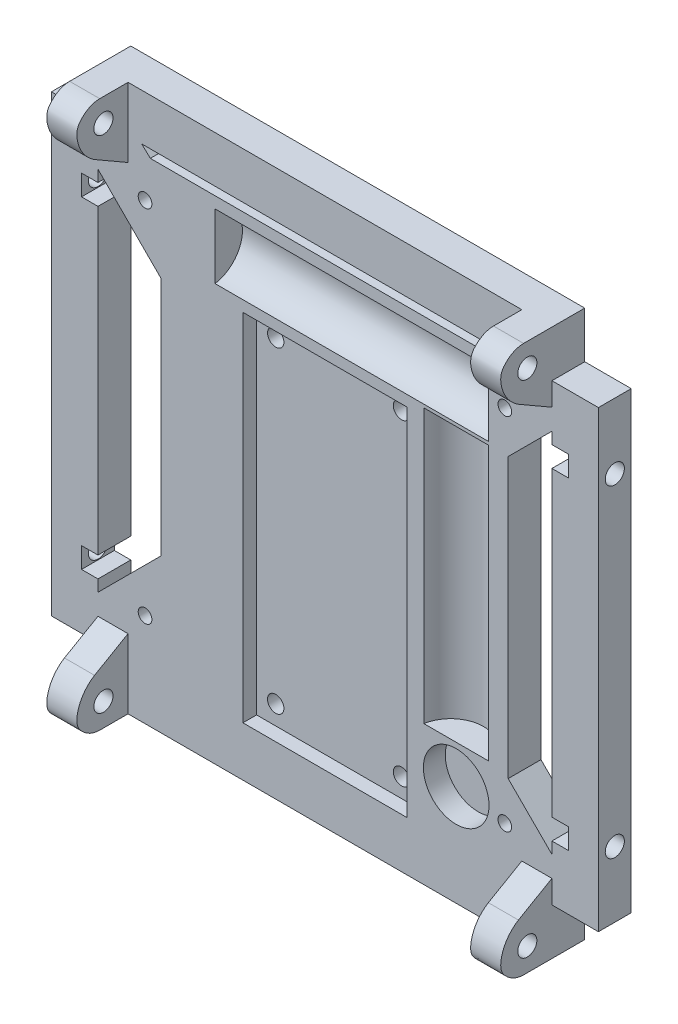
from build123d import *

# Parameters (mm, degrees)
BOSS_EXTRUDE1_DEPTH      = 6
CUT_EXTRUDE1_DEPTH       = 6
BOSS_EXTRUDE2_DEPTH      = 5.5
MIRROR2_COPY_1_DEPTH     = 5.5
SKETCH4_R                = 1.25
CUT_EXTRUDE2_DEPTH       = 73.359459738
MIRROR4_COPY_1_SKETCH_R  = 1.25
MIRROR4_COPY_1_DEPTH     = 73.359459738
SKETCH5_R                = 1.75
CUT_EXTRUDE3_DEPTH       = 5.5
CUT_EXTRUDE4_REACH       = 74.359
SKETCH7_W                = 3
SKETCH7_H                = 3.77
MIRROR8_COPY_1_REACH     = 74.359
MIRROR8_COPY_1_SKETCH_W  = 3
MIRROR8_COPY_1_SKETCH_H  = 3.77
MIRROR12_COPY_1_SKETCH_R = 1.75
MIRROR12_COPY_1_DEPTH    = 5.5
CUT_EXTRUDE7_DEPTH       = 50
CUT_EXTRUDE8_DEPTH       = 50
SKETCH14_R               = 6
CUT_EXTRUDE9_DEPTH       = 4
SKETCH15_W               = 30
SKETCH15_H               = 65
CUT_EXTRUDE10_DEPTH      = 2.5
SKETCH17_R               = 1.5
CUT_EXTRUDE11_DEPTH      = 5


with BuildPart() as part:
    # Sketch1 → Boss-Extrude1 (new body)
    with BuildSketch(Plane.XY):
        Polygon((-41.5, 50), (41.5, 50), (41.5, 41.5), (50, 41.5), (50, -41.5), (41.5, -41.5), (41.5, -50), (-41.5, -50), (-41.5, -41.5), (-50, -41.5), (-50, 41.5), (-41.5, 41.5), align=None)
    extrude(amount=BOSS_EXTRUDE1_DEPTH)

    # Sketch2 → Cut-Extrude1 (cut)
    with BuildSketch(Plane.XY.offset(6)):
        Polygon((-41.5, 33.5), (-41.5, -33.5), (-30, -22), (-30, 22), align=None)
        Polygon((41.5, 33.5), (33.5, 25.5), (33.5, -25.5), (41.5, -33.5), align=None)
        Polygon((33.5, 41.5), (-33.5, 41.5), (-31.926477863, 39.994891869), (31.926477863, 39.994891869), align=None)
    extrude(amount=-CUT_EXTRUDE1_DEPTH, mode=Mode.SUBTRACT)

    # Sketch3 → Boss-Extrude2 (add)
    with BuildSketch(Plane(origin=(41.5, 0, 0), x_dir=(0, 0, -1), z_dir=(1, 0, 0))):
        with BuildLine():
            Line((-6, 37.3), (-6, 41.5))
            Line((-6, 41.5), (-6, 50))
            Line((-6, 50), (-11.178922224, 50))
            Line((-11.178922224, 50), (-11.466360598, 47.208988415))
            ThreePointArc((-11.466360598, 47.208988415), (-9.671939328, 47.291692422), (-8.75, 45.75))
            ThreePointArc((-8.75, 45.75), (-9.834235219, 44.131588045), (-11.743436864, 44.518592365))
            Line((-11.743436864, 44.518592365), (-12.122799605, 40.835))
            Line((-12.122799605, 40.835), (-6, 37.3))
        make_face()
        with BuildLine():
            add(Edge.make_bspline(
                [(-13.748830972, 42.243), (-13.287280997, 41.698559915), (-12.740439433, 41.224797274), (-12.122799605, 40.835)],
                knots=[0.829947962, 0.829947962, 0.829947962, 0.829947962, 1, 1, 1, 1], degree=3))
            Line((-12.122799605, 40.835), (-11.743436864, 44.518592365))
            ThreePointArc((-11.743436864, 44.518592365), (-11.889211305, 44.685766967), (-12.01266876, 44.870037942))
            Line((-12.01266876, 44.870037942), (-13.748830972, 42.243))
        make_face()
        with BuildLine():
            add(Edge.make_bspline(
                [(-15.180860914, 45.042121137), (-14.915949081, 43.985727264), (-14.423515632, 43.038851791), (-13.748830972, 42.243)],
                knots=[0.581369243, 0.581369243, 0.581369243, 0.581369243, 0.829947962, 0.829947962, 0.829947962, 0.829947962], degree=3))
            Line((-13.748830972, 42.243), (-12.01266876, 44.870037942))
            ThreePointArc((-12.01266876, 44.870037942), (-12.127586755, 45.106990392), (-12.205646827, 45.358504276))
            Line((-12.205646827, 45.358504276), (-15.180860914, 45.042121137))
        make_face()
        with BuildLine():
            add(Edge.make_bspline(
                [(-15.120890934, 47.5875), (-15.460705735, 46.824831349), (-15.395381329, 45.897568208), (-15.180860914, 45.042121137)],
                knots=[0.380075065, 0.380075065, 0.380075065, 0.380075065, 0.581369243, 0.581369243, 0.581369243, 0.581369243], degree=3))
            Line((-15.180860914, 45.042121137), (-12.205646827, 45.358504276))
            ThreePointArc((-12.205646827, 45.358504276), (-12.241108324, 45.573813155), (-12.24949925, 45.791861369))
            Line((-12.24949925, 45.791861369), (-15.120890934, 47.5875))
        make_face()
        with BuildLine():
            ThreePointArc((-12.24949925, 45.791861369), (-12.236392573, 45.967809165), (-12.205635976, 46.141542994))
            Line((-12.205635976, 46.141542994), (-14.210030358, 48.7575))
            add(Edge.make_bspline(
                [(-14.210030358, 48.7575), (-14.58769334, 48.419983952), (-14.922993936, 48.031653216), (-15.120890934, 47.5875)],
                knots=[0.262847935, 0.262847935, 0.262847935, 0.262847935, 0.380075065, 0.380075065, 0.380075065, 0.380075065], degree=3))
            Line((-15.120890934, 47.5875), (-12.24949925, 45.791861369))
        make_face()
        with BuildLine():
            Line((-11.807057512, 46.913658309), (-12.117521955, 49.8875))
            add(Edge.make_bspline(
                [(-12.117521955, 49.8875), (-12.889625391, 49.709440811), (-13.60431339, 49.298827076), (-14.210030358, 48.7575)],
                knots=[0.074832522, 0.074832522, 0.074832522, 0.074832522, 0.262847935, 0.262847935, 0.262847935, 0.262847935], degree=3))
            Line((-14.210030358, 48.7575), (-12.205635976, 46.141542994))
            ThreePointArc((-12.205635976, 46.141542994), (-12.055030877, 46.552732192), (-11.807057512, 46.913658309))
        make_face()
        with BuildLine():
            Line((-11.650860914, 47.068339545), (-11.650860914, 49.9675))
            add(Edge.make_bspline(
                [(-11.650860914, 49.9675), (-11.807805321, 49.949182677), (-11.963801555, 49.92295034), (-12.117521955, 49.8875)],
                knots=[0.037399967, 0.037399967, 0.037399967, 0.037399967, 0.074832522, 0.074832522, 0.074832522, 0.074832522], degree=3))
            Line((-12.117521955, 49.8875), (-11.807057512, 46.913658309))
            ThreePointArc((-11.807057512, 46.913658309), (-11.731390401, 46.993453932), (-11.650860914, 47.068339545))
        make_face()
        with BuildLine():
            Line((-11.466360598, 47.208988415), (-11.178922224, 50))
            add(Edge.make_bspline(
                [(-11.178922224, 50), (-11.336298844, 49.996201513), (-11.49405314, 49.985801376), (-11.650860914, 49.9675)],
                knots=[0, 0, 0, 0, 0.037399967, 0.037399967, 0.037399967, 0.037399967], degree=3))
            Line((-11.650860914, 49.9675), (-11.650860914, 47.068339545))
            ThreePointArc((-11.650860914, 47.068339545), (-11.560944042, 47.141724736), (-11.466360598, 47.208988415))
        make_face()
    boss_extrude2 = extrude(amount=-BOSS_EXTRUDE2_DEPTH)

    # Mirror1: Boss-Extrude2 across plane
    add(boss_extrude2.mirror(Plane(origin=(0, 0, 0), x_dir=(0, 0, 1), z_dir=(1, 0, 0))))

    # Mirror2: Boss-Extrude2 across plane
    add(boss_extrude2.mirror(Plane.ZX))

    # Mirror2 copy 1 sketch → Mirror2 copy 1 (add)
    with BuildSketch(Plane(origin=(-41.5, 0, 0), x_dir=(0, 0, -1), z_dir=(-1, 0, 0))):
        with BuildLine():
            Line((-6, 37.3), (-6, 41.5))
            Line((-6, 41.5), (-6, 50))
            Line((-6, 50), (-11.178922224, 50))
            Line((-11.178922224, 50), (-11.466360598, 47.208988415))
            ThreePointArc((-11.466360598, 47.208988415), (-9.671939328, 47.291692422), (-8.75, 45.75))
            ThreePointArc((-8.75, 45.75), (-9.834235219, 44.131588045), (-11.743436864, 44.518592365))
            Line((-11.743436864, 44.518592365), (-12.122799605, 40.835))
            Line((-12.122799605, 40.835), (-6, 37.3))
        make_face()
        with BuildLine():
            add(Edge.make_bspline(
                [(-13.748830972, 42.243), (-13.287280997, 41.698559915), (-12.740439433, 41.224797274), (-12.122799605, 40.835)],
                knots=[0.829947962, 0.829947962, 0.829947962, 0.829947962, 1, 1, 1, 1], degree=3))
            Line((-12.122799605, 40.835), (-11.743436864, 44.518592365))
            ThreePointArc((-11.743436864, 44.518592365), (-11.889211305, 44.685766967), (-12.01266876, 44.870037942))
            Line((-12.01266876, 44.870037942), (-13.748830972, 42.243))
        make_face()
        with BuildLine():
            add(Edge.make_bspline(
                [(-15.180860914, 45.042121137), (-14.915949081, 43.985727264), (-14.423515632, 43.038851791), (-13.748830972, 42.243)],
                knots=[0.581369243, 0.581369243, 0.581369243, 0.581369243, 0.829947962, 0.829947962, 0.829947962, 0.829947962], degree=3))
            Line((-13.748830972, 42.243), (-12.01266876, 44.870037942))
            ThreePointArc((-12.01266876, 44.870037942), (-12.127586755, 45.106990392), (-12.205646827, 45.358504276))
            Line((-12.205646827, 45.358504276), (-15.180860914, 45.042121137))
        make_face()
        with BuildLine():
            add(Edge.make_bspline(
                [(-15.120890934, 47.5875), (-15.460705735, 46.824831349), (-15.395381329, 45.897568208), (-15.180860914, 45.042121137)],
                knots=[0.380075065, 0.380075065, 0.380075065, 0.380075065, 0.581369243, 0.581369243, 0.581369243, 0.581369243], degree=3))
            Line((-15.180860914, 45.042121137), (-12.205646827, 45.358504276))
            ThreePointArc((-12.205646827, 45.358504276), (-12.241108324, 45.573813155), (-12.24949925, 45.791861369))
            Line((-12.24949925, 45.791861369), (-15.120890934, 47.5875))
        make_face()
        with BuildLine():
            ThreePointArc((-12.24949925, 45.791861369), (-12.236392573, 45.967809165), (-12.205635976, 46.141542994))
            Line((-12.205635976, 46.141542994), (-14.210030358, 48.7575))
            add(Edge.make_bspline(
                [(-14.210030358, 48.7575), (-14.58769334, 48.419983952), (-14.922993936, 48.031653216), (-15.120890934, 47.5875)],
                knots=[0.262847935, 0.262847935, 0.262847935, 0.262847935, 0.380075065, 0.380075065, 0.380075065, 0.380075065], degree=3))
            Line((-15.120890934, 47.5875), (-12.24949925, 45.791861369))
        make_face()
        with BuildLine():
            Line((-11.807057512, 46.913658309), (-12.117521955, 49.8875))
            add(Edge.make_bspline(
                [(-12.117521955, 49.8875), (-12.889625391, 49.709440811), (-13.60431339, 49.298827076), (-14.210030358, 48.7575)],
                knots=[0.074832522, 0.074832522, 0.074832522, 0.074832522, 0.262847935, 0.262847935, 0.262847935, 0.262847935], degree=3))
            Line((-14.210030358, 48.7575), (-12.205635976, 46.141542994))
            ThreePointArc((-12.205635976, 46.141542994), (-12.055030877, 46.552732192), (-11.807057512, 46.913658309))
        make_face()
        with BuildLine():
            Line((-11.650860914, 47.068339545), (-11.650860914, 49.9675))
            add(Edge.make_bspline(
                [(-11.650860914, 49.9675), (-11.807805321, 49.949182677), (-11.963801555, 49.92295034), (-12.117521955, 49.8875)],
                knots=[0.037399967, 0.037399967, 0.037399967, 0.037399967, 0.074832522, 0.074832522, 0.074832522, 0.074832522], degree=3))
            Line((-12.117521955, 49.8875), (-11.807057512, 46.913658309))
            ThreePointArc((-11.807057512, 46.913658309), (-11.731390401, 46.993453932), (-11.650860914, 47.068339545))
        make_face()
        with BuildLine():
            Line((-11.466360598, 47.208988415), (-11.178922224, 50))
            add(Edge.make_bspline(
                [(-11.178922224, 50), (-11.336298844, 49.996201513), (-11.49405314, 49.985801376), (-11.650860914, 49.9675)],
                knots=[0, 0, 0, 0, 0.037399967, 0.037399967, 0.037399967, 0.037399967], degree=3))
            Line((-11.650860914, 49.9675), (-11.650860914, 47.068339545))
            ThreePointArc((-11.650860914, 47.068339545), (-11.560944042, 47.141724736), (-11.466360598, 47.208988415))
        make_face()
    extrude(amount=-MIRROR2_COPY_1_DEPTH)

    # Sketch4 → Cut-Extrude2 (cut, through all)
    with BuildSketch(Plane.XY):
        with Locations(Location((32.89, 32.89, 0), (0, 0, 180))):
            Circle(SKETCH4_R)
    cut_extrude2 = extrude(amount=CUT_EXTRUDE2_DEPTH, mode=Mode.SUBTRACT)

    # Mirror3: Cut-Extrude2 across plane
    add(cut_extrude2.mirror(Plane.ZX), mode=Mode.SUBTRACT)

    # Mirror4: Cut-Extrude2 across plane
    add(cut_extrude2.mirror(Plane(origin=(0, 0, 0), x_dir=(0, 0, 1), z_dir=(1, 0, 0))), mode=Mode.SUBTRACT)

    # Mirror4 copy 1 sketch → Mirror4 copy 1 (cut, through all)
    with BuildSketch(Plane(origin=(0, 0, 0), x_dir=(-1, 0, 0), z_dir=(0, 0, 1))):
        with Locations(Location((32.89, 32.89, 0), (0, 0, 180))):
            Circle(MIRROR4_COPY_1_SKETCH_R)
    extrude(amount=MIRROR4_COPY_1_DEPTH, mode=Mode.SUBTRACT)

    # Sketch5 → Cut-Extrude3 (cut)
    with BuildSketch(Plane.ZY.offset(50)):
        with Locations(Location((3, 29.5, 0), (0, 0, 270))):
            Circle(SKETCH5_R)
    cut_extrude3 = extrude(amount=-CUT_EXTRUDE3_DEPTH, mode=Mode.SUBTRACT)

    # Sketch7 → Cut-Extrude4 (cut, up to next)
    with BuildSketch(Plane.XY, mode=Mode.PRIVATE) as cut_extrude4_sk1:
        with Locations((-43, 29.495)):
            Rectangle(SKETCH7_W, SKETCH7_H)
    cut_extrude4_tool1 = extrude(cut_extrude4_sk1.sketch, amount=CUT_EXTRUDE4_REACH, mode=Mode.PRIVATE) & part.part
    cut_extrude4 = cut_extrude4_tool1.solids().sort_by_distance((-43, 29.495, 0))[0]
    add(cut_extrude4, mode=Mode.SUBTRACT)

    # Mirror7: Cut-Extrude4 across plane
    add(cut_extrude4.mirror(Plane.ZX), mode=Mode.SUBTRACT)

    # Mirror8: Cut-Extrude4 across plane
    add(cut_extrude4.mirror(Plane(origin=(0, 0, 0), x_dir=(0, 0, 1), z_dir=(1, 0, 0))), mode=Mode.SUBTRACT)

    # Mirror8 copy 1 sketch → Mirror8 copy 1 (cut, up to next)
    with BuildSketch(Plane(origin=(0, 0, 0), x_dir=(-1, 0, 0), z_dir=(0, 0, 1)), mode=Mode.PRIVATE) as mirror8_copy_1_sk1:
        with Locations((-43, 29.495)):
            Rectangle(MIRROR8_COPY_1_SKETCH_W, MIRROR8_COPY_1_SKETCH_H)
    mirror8_copy_1_tool1 = extrude(mirror8_copy_1_sk1.sketch, amount=MIRROR8_COPY_1_REACH, mode=Mode.PRIVATE) & part.part
    add(mirror8_copy_1_tool1.solids().sort_by_distance((43, -29.495, 0))[0], mode=Mode.SUBTRACT)

    # Mirror11: Cut-Extrude3 across plane
    add(cut_extrude3.mirror(Plane(origin=(0, 0, 0), x_dir=(0, 0, 1), z_dir=(1, 0, 0))), mode=Mode.SUBTRACT)

    # Mirror12: Cut-Extrude3 across plane
    add(cut_extrude3.mirror(Plane.ZX), mode=Mode.SUBTRACT)

    # Mirror12 copy 1 sketch → Mirror12 copy 1 (cut)
    with BuildSketch(Plane(origin=(50, 0, 0), x_dir=(0, 0, 1), z_dir=(1, 0, 0))):
        with Locations(Location((3, 29.5, 0), (0, 0, 270))):
            Circle(MIRROR12_COPY_1_SKETCH_R)
    extrude(amount=-MIRROR12_COPY_1_DEPTH, mode=Mode.SUBTRACT)

    # Sketch11 → Cut-Extrude7 (cut)
    with BuildSketch(Plane(origin=(0, 25.5, 0), x_dir=(1, 0, 0), z_dir=(0, 1, 0))):
        with BuildLine():
            Line((18.083920217, -6), (29.916079783, -6))
            ThreePointArc((29.916079783, -6), (24, -1), (18.083920217, -6))
        make_face()
    extrude(amount=-CUT_EXTRUDE7_DEPTH, mode=Mode.SUBTRACT)

    # Sketch9 → Cut-Extrude8 (cut)
    with BuildSketch(Plane(origin=(29.92, 0, 0), x_dir=(0, 0, -1), z_dir=(1, 0, 0))):
        with BuildLine():
            Line((-6, 37.916079783), (-6, 26.083920217))
            ThreePointArc((-6, 26.083920217), (-1, 32), (-6, 37.916079783))
        make_face()
    extrude(amount=-CUT_EXTRUDE8_DEPTH, mode=Mode.SUBTRACT)

    # Sketch14 → Cut-Extrude9 (cut)
    with BuildSketch(Plane.XY.offset(6)):
        with Locations((24, -31.5)):
            Circle(SKETCH14_R)
    extrude(amount=-CUT_EXTRUDE9_DEPTH, mode=Mode.SUBTRACT)

    # Sketch15 → Cut-Extrude10 (cut)
    with BuildSketch(Plane.XY.offset(6)):
        with Locations((0, -8.416079783)):
            Rectangle(SKETCH15_W, SKETCH15_H)
    extrude(amount=-CUT_EXTRUDE10_DEPTH, mode=Mode.SUBTRACT)

    # Sketch17 → Cut-Extrude11 (cut)
    with BuildSketch(Plane.XY.offset(3.5)):
        with Locations((-11.5, 20.573920217)):
            Circle(SKETCH17_R)
        with Locations((11.5, 20.573920217)):
            Circle(SKETCH17_R)
        with Locations((-11.5, -37.406079783)):
            Circle(SKETCH17_R)
        with Locations((11.5, -37.406079783)):
            Circle(SKETCH17_R)
    extrude(amount=-CUT_EXTRUDE11_DEPTH, mode=Mode.SUBTRACT)


solid = part.part
